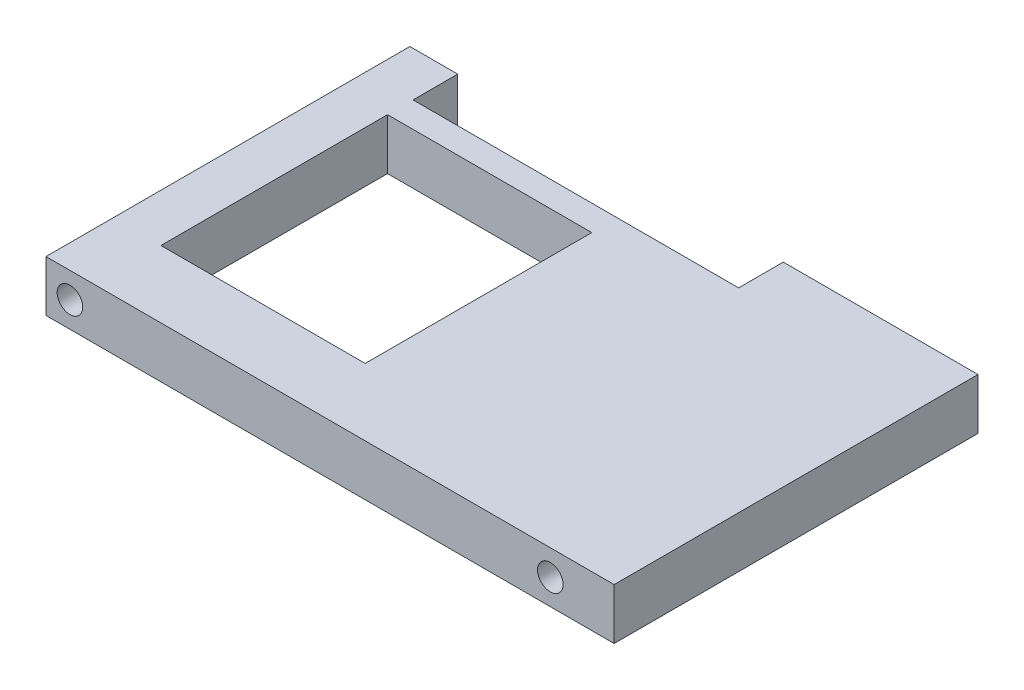
from build123d import *

# Parameters (mm, degrees)
SKETCH1_W           = 89
SKETCH1_H           = 57
BOSS_EXTRUDE1_DEPTH = 8
SKETCH2_W           = 32
SKETCH2_H           = 35.5
SKETCH2_H_2         = 6
SKETCH2_W_2         = 19
SKETCH2_H_3         = 1
CUT_EXTRUDE2_DEPTH  = 106.990565618
SKETCH3_R           = 2
CUT_EXTRUDE3_DEPTH  = 6.7


with BuildPart() as part:
    # Sketch1 → Boss-Extrude1 (new body)
    with BuildSketch(Plane(origin=(0, 0, 0), x_dir=(1, 0, 0), z_dir=(0, 1, 0))):
        with Locations((44.5, 28.5)):
            Rectangle(SKETCH1_W, SKETCH1_H)
    extrude(amount=BOSS_EXTRUDE1_DEPTH)

    # Sketch2 → Cut-Extrude2 (cut, through all)
    with BuildSketch(Plane(origin=(0, 8, 0), x_dir=(1, 0, 0), z_dir=(0, 1, 0))):
        with Locations((23.5, 28.25)):
            Rectangle(SKETCH2_W, SKETCH2_H)
        with Locations((23.5, 53)):
            Rectangle(SKETCH2_W, SKETCH2_H_2)
        with Locations((49, 53)):
            Rectangle(SKETCH2_W_2, SKETCH2_H_2)
        with Locations((49, 56.5)):
            Rectangle(SKETCH2_W_2, SKETCH2_H_3)
        with Locations((23.5, 56.5)):
            Rectangle(SKETCH2_W, SKETCH2_H_3)
    extrude(amount=-CUT_EXTRUDE2_DEPTH, mode=Mode.SUBTRACT)

    # Sketch3 → Cut-Extrude3 (cut)
    with BuildSketch(Plane.XY):
        with Locations((3.75, 4)):
            Circle(SKETCH3_R)
        with Locations((79, 4)):
            Circle(SKETCH3_R)
    cut_extrude3 = extrude(amount=-CUT_EXTRUDE3_DEPTH, mode=Mode.SUBTRACT)

    # Mirror1: Cut-Extrude3 across plane
    add(cut_extrude3.mirror(Plane.XY.offset(-28.5)), mode=Mode.SUBTRACT)


solid = part.part
